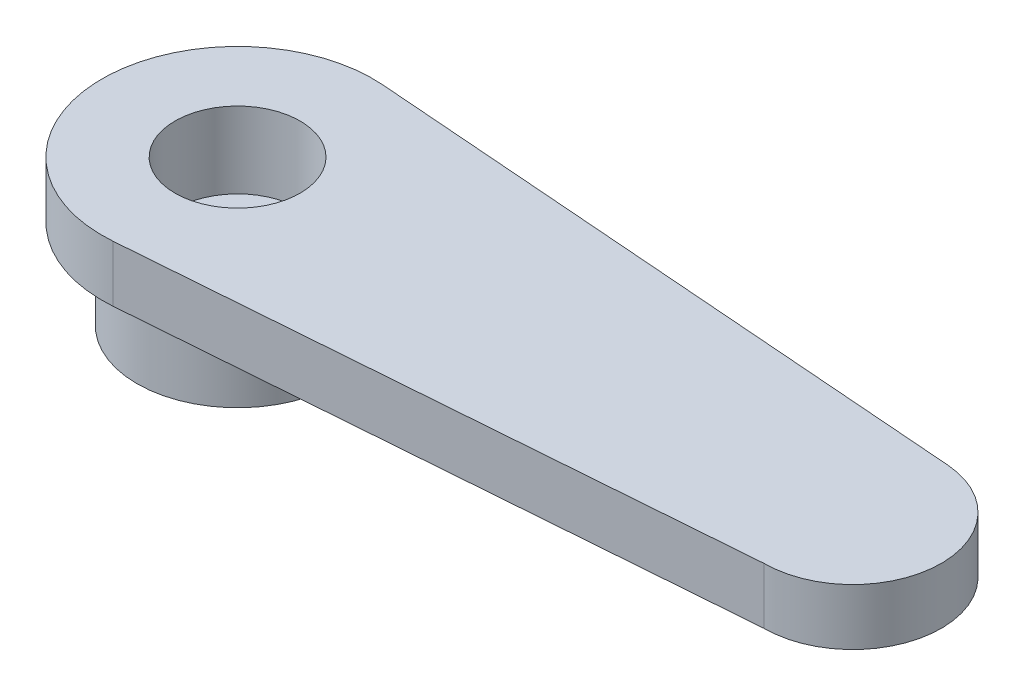
from build123d import *

# Parameters (mm, degrees)
RESSALTO_EXTRUS_O1_DEPTH = 2.7
ESBO_O1_6_R              = 4.825
RESSALTO_EXTRUS_O2_DEPTH = 4.3
ESBO_O4_R                = 3
CORTE_EXTRUS_O1_DEPTH    = 3.65
ESBO_O5_R                = 2
CORTE_EXTRUS_O2_DEPTH    = 3.65


with BuildPart() as part:
    # Esboço1 → Ressalto-extrusão1 (new body)
    with BuildSketch(Plane(origin=(0, 0, 0), x_dir=(1, 0, 0), z_dir=(0, 1, 0))):
        with BuildLine():
            Line((0.495762712, 6.481066219), (29.824152542, 4.23762022))
            ThreePointArc((29.824152542, 4.23762022), (33.746903927, -0.162194428), (29.5, -4.25))
            Line((29.5, -4.25), (0.498520942, -6.48085464))
            ThreePointArc((0.498520942, -6.48085464), (-6.499999853, -0.001383166), (0.495762712, 6.481066219))
        make_face()
    extrude(amount=RESSALTO_EXTRUS_O1_DEPTH)

    # Esboço1<6> → Ressalto-extrusão2 (add)
    with BuildSketch(Plane(origin=(0, 0, 0), x_dir=(1, 0, 0), z_dir=(0, 1, 0))):
        Circle(ESBO_O1_6_R)
    extrude(amount=-RESSALTO_EXTRUS_O2_DEPTH)

    # Esboço4 → Corte-extrusão1 (cut)
    with BuildSketch(Plane(origin=(0, 2.7, 0), x_dir=(1, 0, 0), z_dir=(0, 1, 0))):
        Circle(ESBO_O4_R)
    extrude(amount=-CORTE_EXTRUS_O1_DEPTH, mode=Mode.SUBTRACT)

    # Esboço5 → Corte-extrusão2 (cut)
    with BuildSketch(Plane(origin=(0, -0.95, 0), x_dir=(1, 0, 0), z_dir=(0, 1, 0))):
        Circle(ESBO_O5_R)
    extrude(amount=-CORTE_EXTRUS_O2_DEPTH, mode=Mode.SUBTRACT)


solid = part.part
